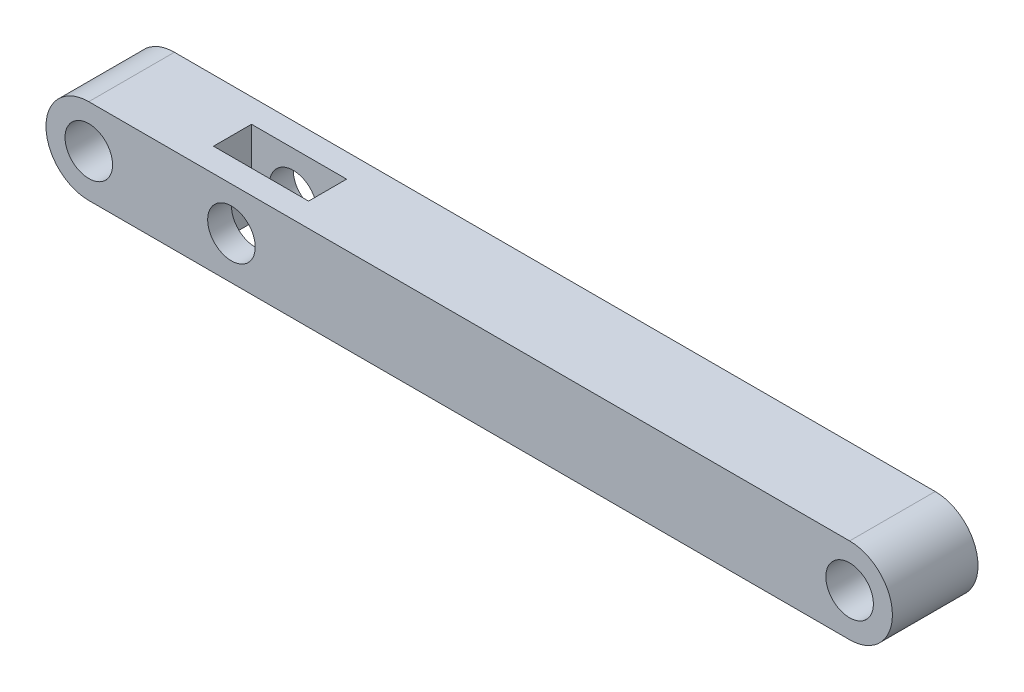
from build123d import *

# Parameters (mm, degrees)
SKETCH1_R           = 5
BOSS_EXTRUDE1_DEPTH = 18
SKETCH3_W           = 20
SKETCH3_H           = 8
CUT_EXTRUDE1_DEPTH  = 18


with BuildPart() as part:
    # Sketch1 → Boss-Extrude1 (new body)
    with BuildSketch(Plane.XY):
        with BuildLine():
            Line((-30, 9), (130, 9))
            ThreePointArc((130, 9), (139, 0), (130, -9))
            Line((130, -9), (-30, -9))
            ThreePointArc((-30, -9), (-39, 0), (-30, 9))
        make_face()
        Circle(SKETCH1_R, mode=Mode.SUBTRACT)
        with Locations((130, 0)):
            Circle(SKETCH1_R, mode=Mode.SUBTRACT)
        with Locations((-30, 0)):
            Circle(SKETCH1_R, mode=Mode.SUBTRACT)
    extrude(amount=BOSS_EXTRUDE1_DEPTH)

    # Sketch3 → Cut-Extrude1 (cut)
    with BuildSketch(Plane(origin=(0, 9, 0), x_dir=(1, 0, 0), z_dir=(0, 1, 0))):
        with Locations((1.222079484, -9)):
            Rectangle(SKETCH3_W, SKETCH3_H)
    extrude(amount=-CUT_EXTRUDE1_DEPTH, mode=Mode.SUBTRACT)


solid = part.part
